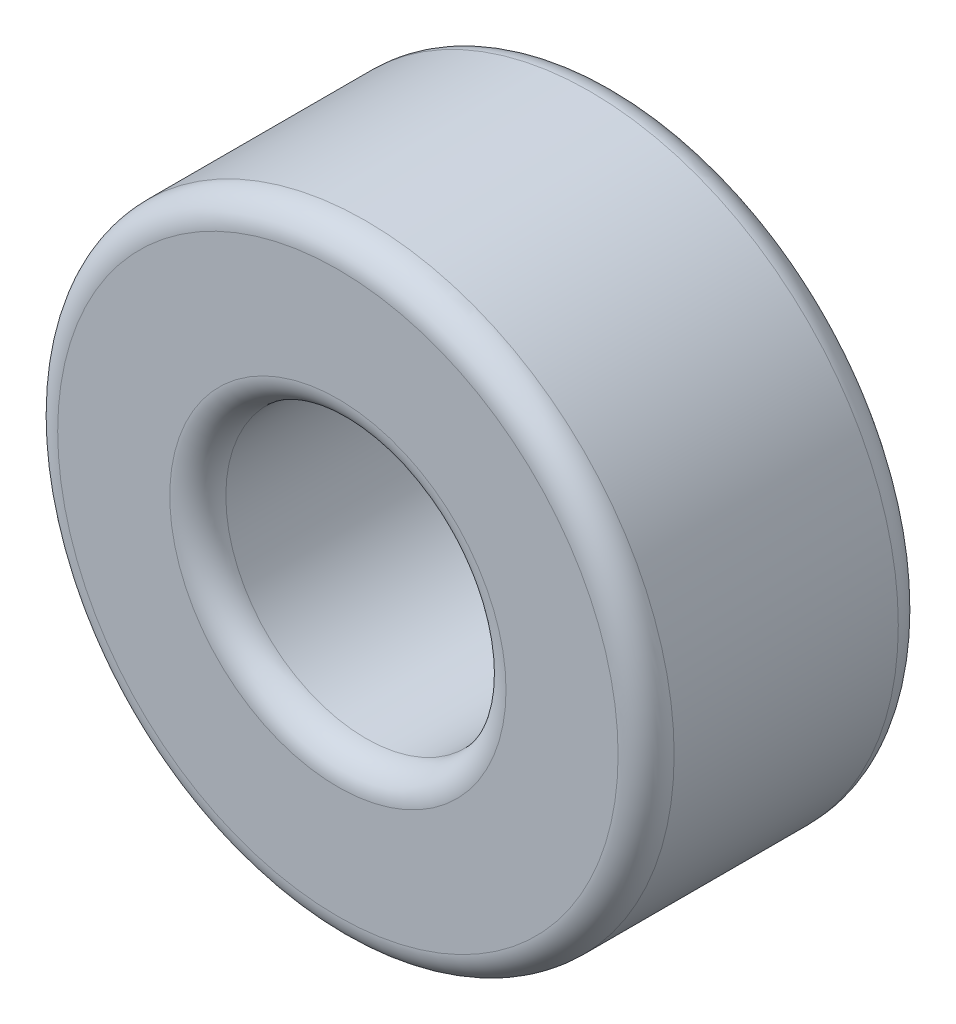
from build123d import *

# Parameters (mm, degrees)
SKETCH_1_R      = 5.5
SKETCH_1_R_2    = 2.5
EXTRUDE_1_DEPTH = 5
FILLET_1_R      = 0.5


with BuildPart() as part:
    # 草图1 → 凸台-拉伸1 (new body)
    with BuildSketch(Plane.XY):
        Circle(SKETCH_1_R)
        Circle(SKETCH_1_R_2, mode=Mode.SUBTRACT)
    extrude(amount=EXTRUDE_1_DEPTH)

    # 圆角1
    fillet_1_edges = [part.edges().sort_by_distance(p)[0] for p in [
        (-5.5, 0, 0),
        (-5.5, 0, 5),
        (-2.5, 0, 0),
        (-2.5, 0, 5),
    ]]
    fillet(fillet_1_edges, radius=FILLET_1_R)


solid = part.part
